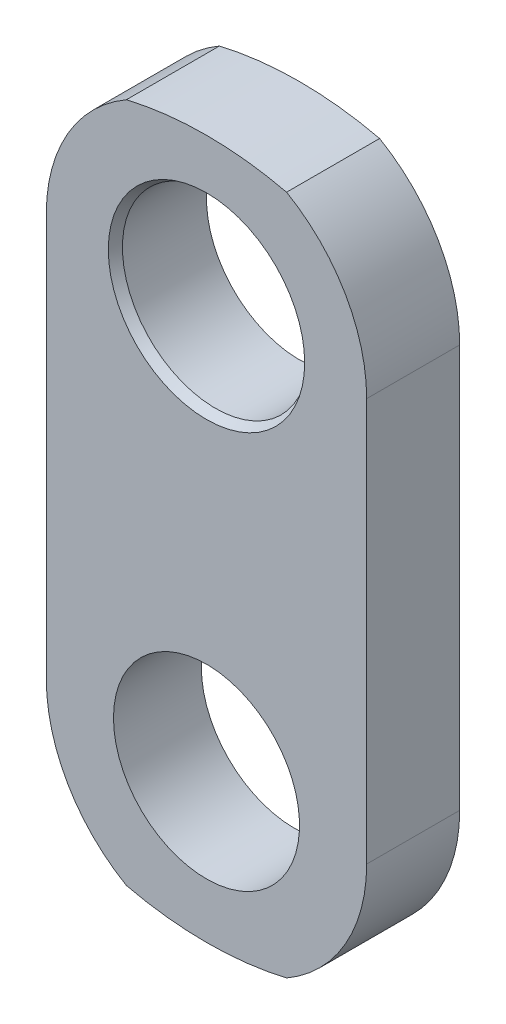
from build123d import *

# Parameters (mm, degrees)
SKETCH_1_R      = 18
EXTRUDE_1_DEPTH = 18
CHAMFER_1_SIZE  = 1
CHAMFER_1_SIZE2 = 1.732050808
CHAMFER_2_SIZE  = 1
CHAMFER_2_SIZE2 = 1.732050808


with BuildPart() as part:
    # Эскиз1 → Бобышка-Вытянуть1 (new body)
    with BuildSketch(Plane.XY):
        with BuildLine():
            Line((-31, 39), (-31, -39))
            ThreePointArc((-31, -39), (-26.846787517, -54.5), (-15.5, -65.846787517))
            ThreePointArc((-15.5, -65.846787517), (0, -67.64650343), (15.5, -65.846787517))
            ThreePointArc((15.5, -65.846787517), (26.846787517, -54.5), (31, -39))
            Line((31, -39), (31, 39))
            ThreePointArc((31, 39), (26.846787517, 54.5), (15.5, 65.846787517))
            ThreePointArc((15.5, 65.846787517), (0, 67.64650343), (-15.5, 65.846787517))
            ThreePointArc((-15.5, 65.846787517), (-26.846787517, 54.5), (-31, 39))
        make_face()
        with Locations((0, 39)):
            Circle(SKETCH_1_R, mode=Mode.SUBTRACT)
        with Locations(Location((0, -39, 0), (0, 0, 180))):
            Circle(SKETCH_1_R, mode=Mode.SUBTRACT)
    extrude(amount=EXTRUDE_1_DEPTH)

    # Фаска1
    chamfer_1_edges = [part.edges().sort_by_distance(p)[0] for p in [
        (-18, 39, 18),
    ]]
    chamfer_1_side = [part.faces().sort_by_distance(p)[0] for p in [
        (0, 0, 18),
    ]]
    chamfer(chamfer_1_edges, length=CHAMFER_1_SIZE, length2=CHAMFER_1_SIZE2, reference=chamfer_1_side[0])

    # Фаска2
    chamfer_2_edges = [part.edges().sort_by_distance(p)[0] for p in [
        (18, -39, 0),
    ]]
    chamfer_2_side = [part.faces().sort_by_distance(p)[0] for p in [
        (18, -39, 9),
    ]]
    chamfer(chamfer_2_edges, length=CHAMFER_2_SIZE, length2=CHAMFER_2_SIZE2, reference=chamfer_2_side[0])


solid = part.part
